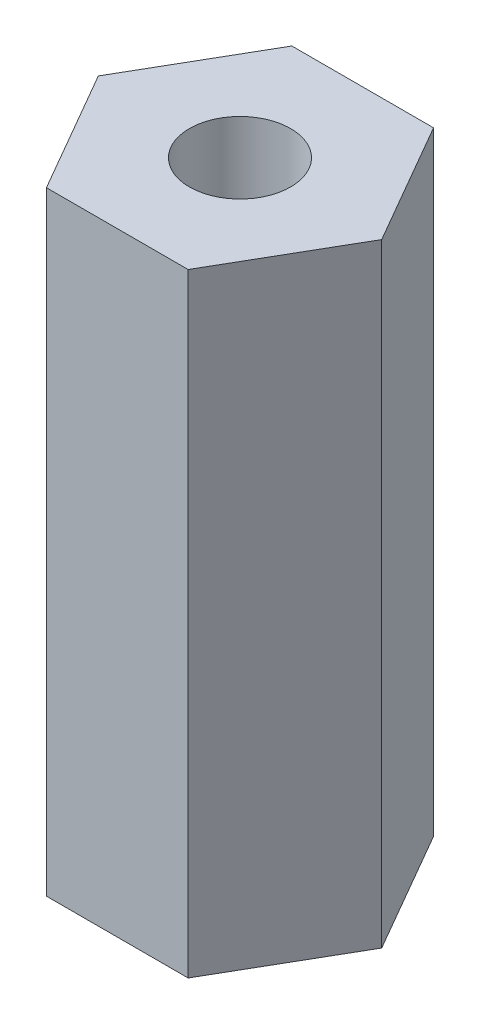
from build123d import *

# Parameters (mm, degrees)
EXTRUDE_1_DEPTH     = 20
SKETCH_2_R          = 1.65
CUT_EXTRUDE_1_DEPTH = 6
CUT_EXTRUDE_START   = -6
SKETCH_3_R          = 1.65
CUT_EXTRUDE_2_DEPTH = 6


with BuildPart() as part:
    # 草图1 → 凸台-拉伸1 (new body)
    with BuildSketch(Plane(origin=(0, 0, 0), x_dir=(1, 0, 0), z_dir=(0, 1, 0))):
        Polygon((4.618802154, 0), (2.309401077, -4), (-2.309401077, -4), (-4.618802154, 0), (-2.309401077, 4), (2.309401077, 4), align=None)
    extrude(amount=EXTRUDE_1_DEPTH)

    # 草图2 → 切除-拉伸1 (cut)
    with BuildSketch(Plane(origin=(0, 0, 0), x_dir=(1, 0, 0), z_dir=(0, 1, 0))):
        with Locations(Location((0, 0, 0), (0, 0, 270))):
            Circle(SKETCH_2_R)
    extrude(amount=CUT_EXTRUDE_1_DEPTH, mode=Mode.SUBTRACT)

    # 草图3 → 切除-拉伸2 (cut)
    with BuildSketch(Plane(origin=(0, 20, 0), x_dir=(1, 0, 0), z_dir=(0, 1, 0)).offset(CUT_EXTRUDE_START)):
        with Locations(Location((0, 0, 0), (0, 0, 270))):
            Circle(SKETCH_3_R)
    extrude(amount=CUT_EXTRUDE_2_DEPTH, mode=Mode.SUBTRACT)


solid = part.part
